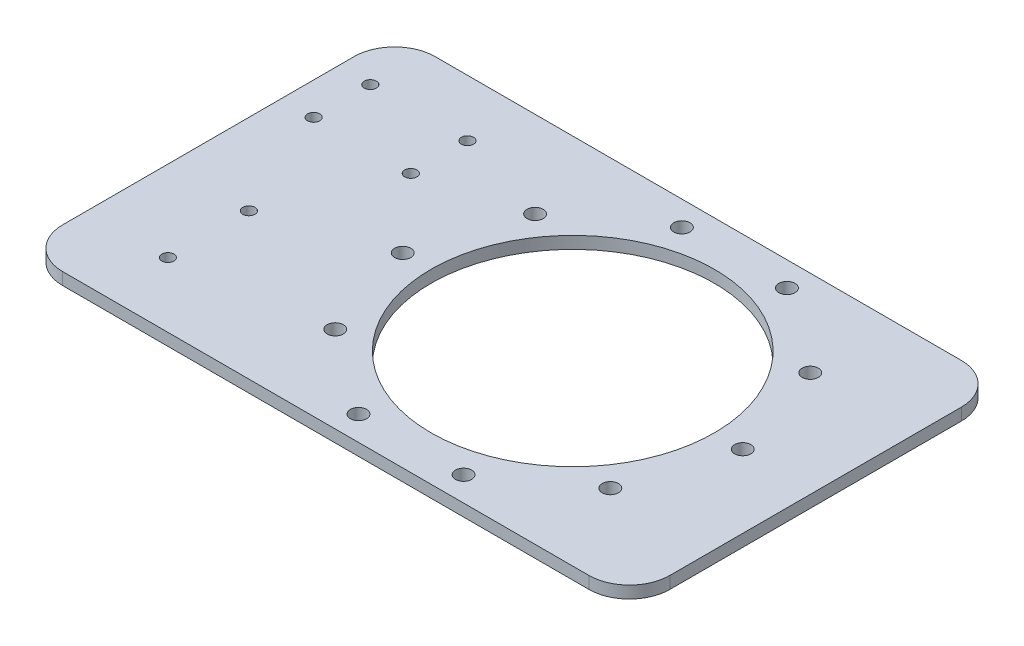
from build123d import *

# Parameters (mm, degrees)
SKETCH_1_W               = 150
SKETCH_1_H               = 92
SKETCH_1_R               = 35
EXTRUDE_1_DEPTH          = 3
CUT_EXTRUDE_1_REACH      = 90.034
SKETCH_2_R               = 2
PATTERN_CIRCULAR_1_COUNT = 10
SKETCH_3_R               = 1.5
CUT_EXTRUDE_2_DEPTH      = 3
FILLET_1_R               = 10


with BuildPart() as part:
    # 草圖1 → 填料-伸長1 (new body)
    with BuildSketch(Plane(origin=(0, 0, 0), x_dir=(1, 0, 0), z_dir=(0, 1, 0))):
        Rectangle(SKETCH_1_W, SKETCH_1_H)
        with Locations(Location((15, 0, 0), (0, 0, 270))):
            Circle(SKETCH_1_R, mode=Mode.SUBTRACT)
    extrude(amount=EXTRUDE_1_DEPTH)

    # 草圖2 → 除料-伸長1 (cut, up to next)
    with BuildSketch(Plane(origin=(0, 3, 0), x_dir=(1, 0, 0), z_dir=(0, 1, 0)), mode=Mode.PRIVATE) as cut_extrude_1_sk1:
        with Locations(Location((57, 0, 0), (0, 0, 270))):
            Circle(SKETCH_2_R)
    cut_extrude_1_tool1 = extrude(cut_extrude_1_sk1.sketch, amount=-CUT_EXTRUDE_1_REACH, mode=Mode.PRIVATE) & part.part
    cut_extrude_1 = cut_extrude_1_tool1.solids().sort_by_distance((57, 3, 0))[0]
    add(cut_extrude_1, mode=Mode.SUBTRACT)

    # 環狀複製排列1: 除料-伸長1 ×10 about axis
    pattern_circular_1_axis = Axis((15, 0, 0), (0, 1, 0))
    for i in range(1, PATTERN_CIRCULAR_1_COUNT):
        add(cut_extrude_1.rotate(pattern_circular_1_axis, i * 360 / PATTERN_CIRCULAR_1_COUNT), mode=Mode.SUBTRACT)

    # 草圖3 → 除料-伸長2 (cut)
    with BuildSketch(Plane(origin=(0, 3, 0), x_dir=(1, 0, 0), z_dir=(0, 1, 0))):
        with Locations(Location((-67, 32, 0), (0, 0, 270))):
            Circle(SKETCH_3_R)
        with Locations(Location((-67, 18, 0), (0, 0, 270))):
            Circle(SKETCH_3_R)
        with Locations(Location((-43, 18, 0), (0, 0, 90))):
            Circle(SKETCH_3_R)
        with Locations(Location((-43, 32, 0), (0, 0, 90))):
            Circle(SKETCH_3_R)
        with Locations(Location((-55, -10, 0), (0, 0, 270))):
            Circle(SKETCH_3_R)
        with Locations(Location((-55, -30, 0), (0, 0, 270))):
            Circle(SKETCH_3_R)
    extrude(amount=-CUT_EXTRUDE_2_DEPTH, mode=Mode.SUBTRACT)

    # 圓角1
    fillet_1_edges = [part.edges().sort_by_distance(p)[0] for p in [
        (75, 1.5, 46),
        (-75, 1.5, 46),
        (-75, 1.5, -46),
        (75, 1.5, -46),
    ]]
    fillet(fillet_1_edges, radius=FILLET_1_R)


solid = part.part
